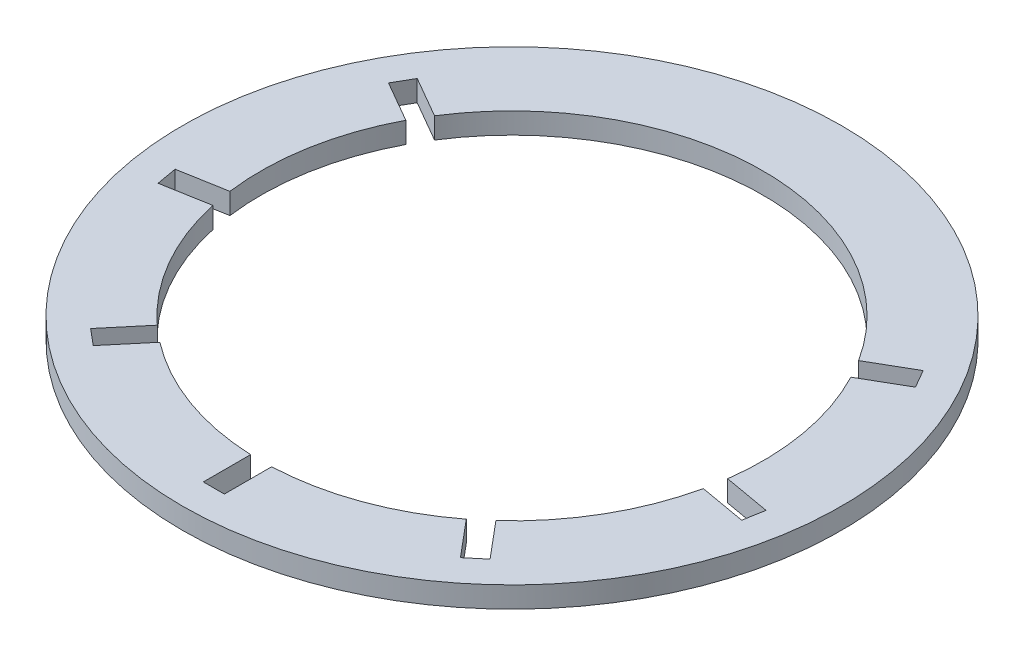
from build123d import *

# Parameters (mm, degrees)
SKETCH1_R           = 105
SKETCH1_R_2         = 80
BOSS_EXTRUDE1_DEPTH = 6.7
SKETCH2_W           = 6.7
SKETCH2_H           = 20
CUT_EXTRUDE3_DEPTH  = 6.7


with BuildPart() as part:
    # Sketch1 → Boss-Extrude1 (new body)
    with BuildSketch(Plane(origin=(0, 0, 0), x_dir=(1, 0, 0), z_dir=(0, 1, 0))):
        with Locations(Location((0, 0, 0), (0, 0, 270))):
            Circle(SKETCH1_R)
        with Locations(Location((0, 0, 0), (0, 0, 270))):
            Circle(SKETCH1_R_2, mode=Mode.SUBTRACT)
    extrude(amount=BOSS_EXTRUDE1_DEPTH)

    # Sketch2 → Cut-Extrude3 (cut)
    with BuildSketch(Plane(origin=(0, 6.7, 0), x_dir=(1, 0, 0), z_dir=(0, 1, 0))):
        Polygon((80.59741336, 50.401185103), (63.276905284, 40.401185103), (66.626905284, 34.598814897), (83.94741336, 44.598814897), align=None)
        Polygon((63.631071805, -70.620883604), (50.775319611, -55.299994741), (45.642821842, -59.606671726), (58.498574036, -74.927560589), align=None)
        Polygon((94.138457931, -13.197470906), (74.442302871, -9.724507352), (73.278860081, -16.322719298), (92.975015141, -19.795682851), align=None)
        with Locations((0, -85)):
            Rectangle(SKETCH2_W, SKETCH2_H)
        Polygon((-58.498574036, -74.927560589), (-45.642821842, -59.606671726), (-50.775319611, -55.299994741), (-63.631071805, -70.620883604), align=None)
        Polygon((-92.975015141, -19.795682851), (-73.278860081, -16.322719298), (-74.442302871, -9.724507352), (-94.138457931, -13.197470906), align=None)
        Polygon((-83.94741336, 44.598814897), (-66.626905284, 34.598814897), (-63.276905284, 40.401185103), (-80.59741336, 50.401185103), align=None)
    extrude(amount=-CUT_EXTRUDE3_DEPTH, mode=Mode.SUBTRACT)


solid = part.part
